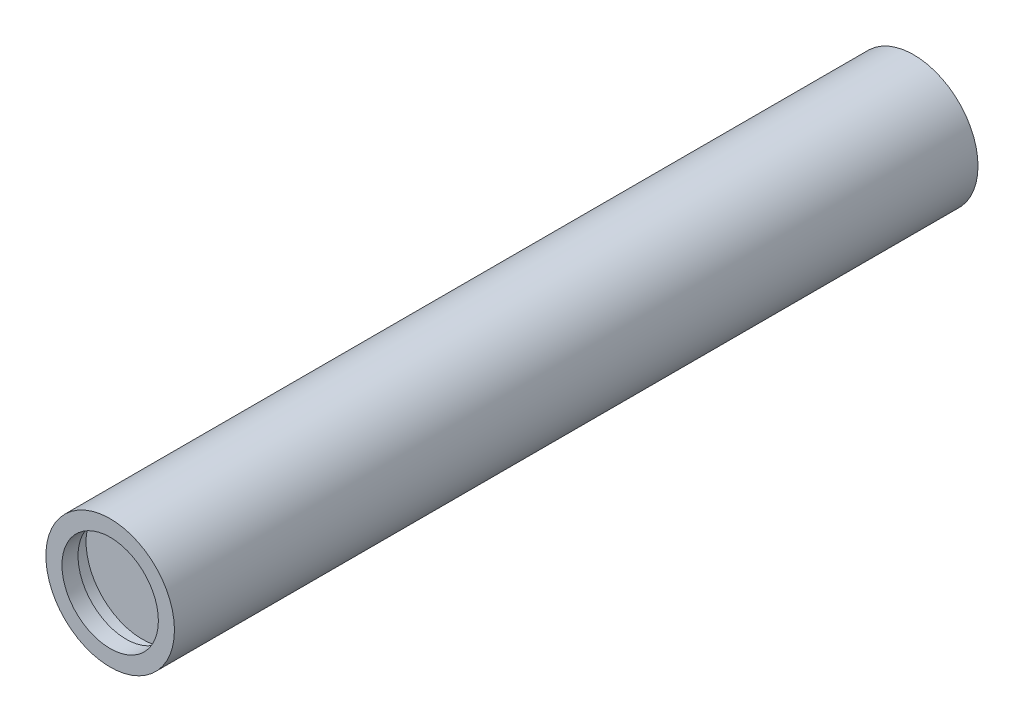
from build123d import *

# Parameters (mm, degrees)
SKETCH1_R           = 40
BOSS_EXTRUDE1_DEPTH = 500
SKETCH2_R           = 30
CUT_EXTRUDE1_DEPTH  = 10
SKETCH3_R           = 35
CUT_EXTRUDE2_DEPTH  = 10


with BuildPart() as part:
    # Sketch1 → Boss-Extrude1 (new body)
    with BuildSketch(Plane.XY):
        Circle(SKETCH1_R)
    extrude(amount=BOSS_EXTRUDE1_DEPTH)

    # Sketch2 → Cut-Extrude1 (cut)
    with BuildSketch(Plane(origin=(0, 0, 500), x_dir=(-1, 0, 0), z_dir=(0, 0, -1))):
        Circle(SKETCH2_R)
    extrude(amount=CUT_EXTRUDE1_DEPTH, mode=Mode.SUBTRACT)

    # Sketch3 → Cut-Extrude2 (cut)
    with BuildSketch(Plane.XY.offset(490)):
        Circle(SKETCH3_R)
    extrude(amount=-CUT_EXTRUDE2_DEPTH, mode=Mode.SUBTRACT)


solid = part.part
